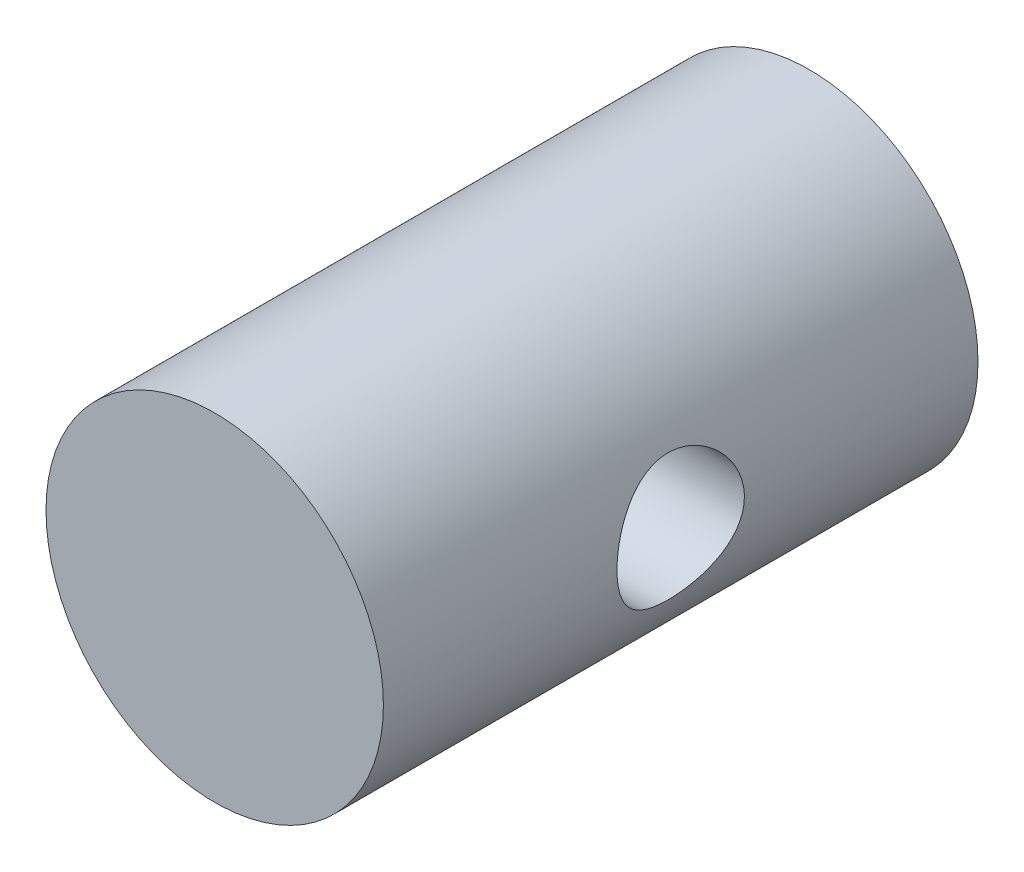
from build123d import *

# Parameters (mm, degrees)
SKETCH1_R               = 12.6111
BOSS_EXTRUDE1_DEPTH     = 44.45
CUT_EXTRUDE1_DEPTH      = 48.894490147
CUT_EXTRUDE1_DEPTH_BACK = 48.894490147
SKETCH2_R               = 4.7625


with BuildPart() as part:
    # Sketch1 → Boss-Extrude1 (new body)
    with BuildSketch(Plane(origin=(0, 0, 0), x_dir=(0, 1, 0), z_dir=(0, 0, 1))):
        with Locations(Location((0, 0, 0), (0, 0, 270))):
            Circle(SKETCH1_R)
    extrude(amount=BOSS_EXTRUDE1_DEPTH)

    # Sketch2 → Cut-Extrude1 (cut, two sides: drawn at the far end of the back side and taken through both)
    with BuildSketch(Plane.YZ.offset(-CUT_EXTRUDE1_DEPTH_BACK)):
        with Locations(Location((0, 22.225, 0), (0, 0, 270))):
            Circle(SKETCH2_R)
    extrude(amount=CUT_EXTRUDE1_DEPTH + CUT_EXTRUDE1_DEPTH_BACK, mode=Mode.SUBTRACT)


solid = part.part
